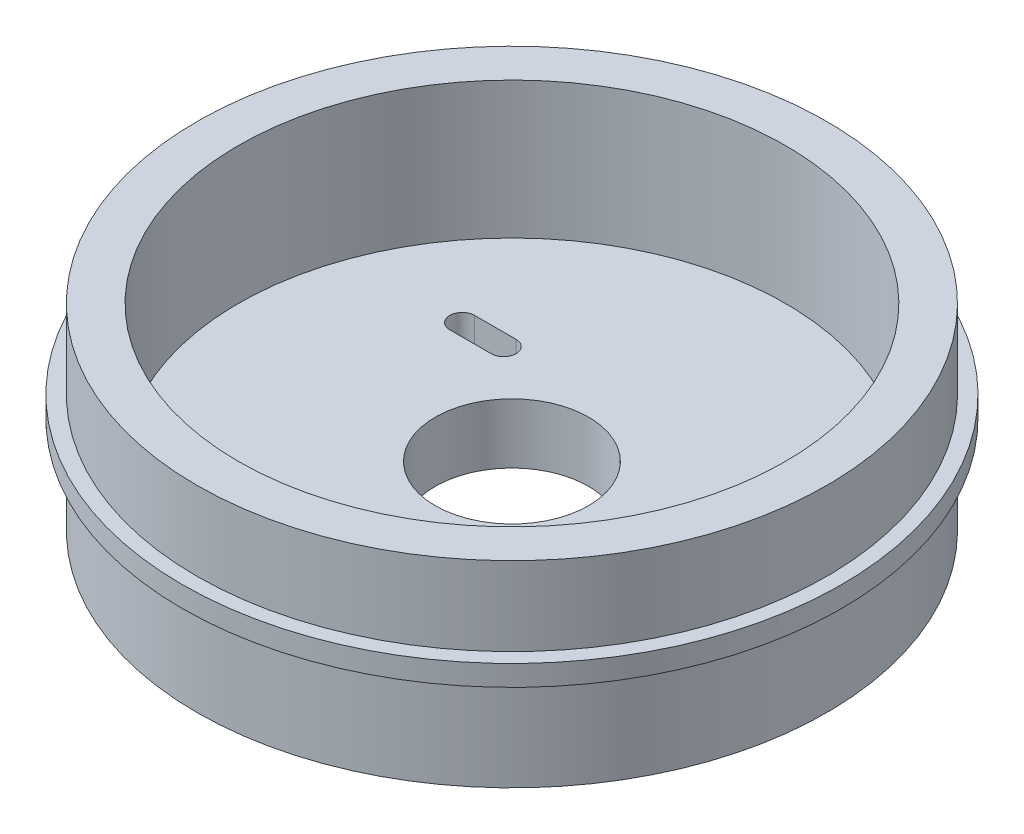
from build123d import *

# Parameters (mm, degrees)
ENL_V_MAT_EXTRU_2_REACH = 117.06


with BuildPart() as part:
    # Esquisse1 → Révolution1 (revolve)
    with BuildSketch(Plane.XY, mode=Mode.PRIVATE) as r_volution1_sk:
        Polygon((-76, 0), (-18.5, 0), (-18.5, 14.461538462), (-66, 14.461538462), (-66, 47.461538462), (-76, 47.461538462), (-76, 28.461538462), (-79.5, 28.461538462), (-79.5, 23.461538462), (-76, 23.461538462), align=None)
    revolve(r_volution1_sk.sketch.rotate(Axis((0, 101.923076923, 0), (0, -1, 0)), 270), axis=Axis((0, 101.923076923, 0), (0, -1, 0)))

    # Esquisse2 → Enlèv. mat.-Extru.2 (cut, up to next)
    with BuildSketch(Plane(origin=(0, 24.461538462, 0), x_dir=(1, 0, 0), z_dir=(0, 1, 0)), mode=Mode.PRIVATE) as enl_v_mat_extru_2_sk1:
        with BuildLine():
            Line((-35, 26), (-25, 26))
            ThreePointArc((-25, 26), (-22, 23), (-25, 20))
            Line((-25, 20), (-35, 20))
            ThreePointArc((-35, 20), (-38, 23), (-35, 26))
        make_face()
    enl_v_mat_extru_2_tool1 = extrude(enl_v_mat_extru_2_sk1.sketch, amount=-ENL_V_MAT_EXTRU_2_REACH, mode=Mode.PRIVATE) & part.part
    add(enl_v_mat_extru_2_tool1.solids().sort_by_distance((-30, 24.461538, -23))[0], mode=Mode.SUBTRACT)


solid = part.part
